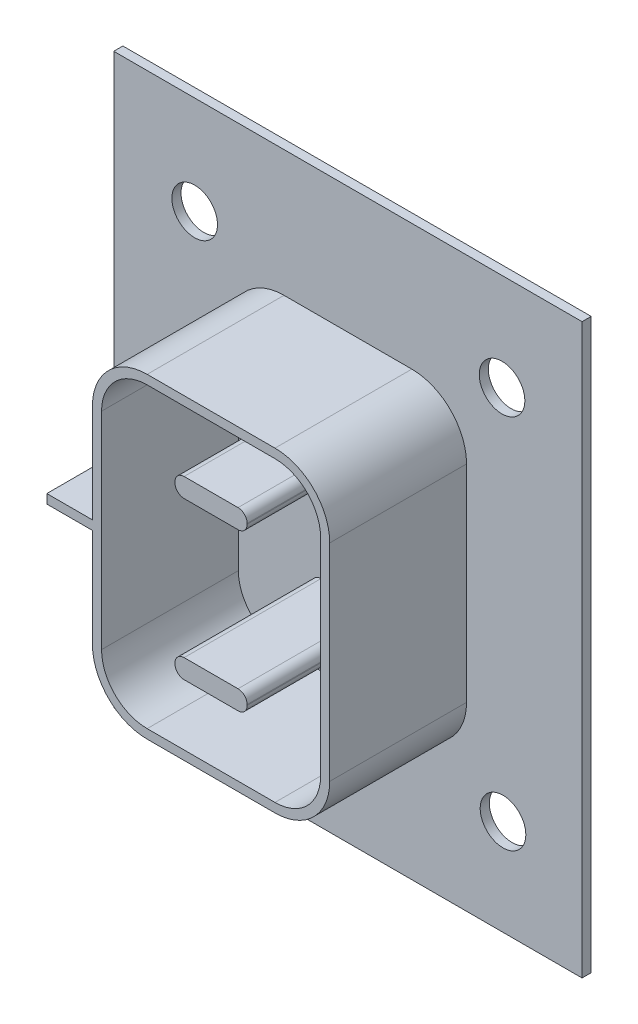
from build123d import *

# Parameters (mm, degrees)
EXTRUDE_1_DEPTH   = 30
EXTRUDE_1_2_DEPTH = 30
EXTRUDE_1_3_DEPTH = 30
SKETCH_2_W        = 102.668849522
SKETCH_2_H        = 124.613288396
SKETCH_2_R        = 5
EXTRUDE_2_DEPTH   = 2


with BuildPart() as part:
    # 草图1 → 凸台-拉伸1 (new body)
    with BuildSketch(Plane.XY):
        with BuildLine():
            ThreePointArc((-26.011198321, 22.633142138), (-22.496479695, 31.118423512), (-14.011198321, 34.633142138))
            Line((-14.011198321, 34.633142138), (14.011198321, 34.633142138))
            ThreePointArc((14.011198321, 34.633142138), (22.496479695, 31.118423512), (26.011198321, 22.633142138))
            Line((26.011198321, 22.633142138), (26.011198321, -22.633142138))
            ThreePointArc((26.011198321, -22.633142138), (22.496479695, -31.118423512), (14.011198321, -34.633142138))
            Line((14.011198321, -34.633142138), (-14.011198321, -34.633142138))
            ThreePointArc((-14.011198321, -34.633142138), (-22.496479695, -31.118423512), (-26.011198321, -22.633142138))
            Line((-26.011198321, -22.633142138), (-26.011198321, -1))
            Line((-26.011198321, -1), (-36.011198321, -1))
            Line((-36.011198321, -1), (-36.011198321, 1))
            Line((-36.011198321, 1), (-26.011198321, 1))
            Line((-26.011198321, 1), (-26.011198321, 22.633142138))
        make_face()
        with BuildLine():
            Line((-24.011198321, 22.633142138), (-24.011198321, -22.633142138))
            ThreePointArc((-24.011198321, -22.633142138), (-21.082266133, -29.70420995), (-14.011198321, -32.633142138))
            Line((-14.011198321, -32.633142138), (14.011198321, -32.633142138))
            ThreePointArc((14.011198321, -32.633142138), (21.082266133, -29.70420995), (24.011198321, -22.633142138))
            Line((24.011198321, -22.633142138), (24.011198321, 22.633142138))
            ThreePointArc((24.011198321, 22.633142138), (21.082266133, 29.70420995), (14.011198321, 32.633142138))
            Line((14.011198321, 32.633142138), (-14.011198321, 32.633142138))
            ThreePointArc((-14.011198321, 32.633142138), (-21.082266133, 29.70420995), (-24.011198321, 22.633142138))
        make_face(mode=Mode.SUBTRACT)
    extrude(amount=EXTRUDE_1_DEPTH)

    # 草图2 → 凸台-拉伸2 (add)
    with BuildSketch(Plane.XY):
        Rectangle(SKETCH_2_W, SKETCH_2_H)
        with Locations((-33.977994318, -41.240450485)):
            Circle(SKETCH_2_R, mode=Mode.SUBTRACT)
        with Locations((34.002429765, -41.270108764)):
            Circle(SKETCH_2_R, mode=Mode.SUBTRACT)
        with Locations((33.788584472, 41.01055618)):
            Circle(SKETCH_2_R, mode=Mode.SUBTRACT)
        with Locations((-33.591248628, 40.771041775)):
            Circle(SKETCH_2_R, mode=Mode.SUBTRACT)
    extrude(amount=-EXTRUDE_2_DEPTH)


with BuildPart() as body_2:
    # 草图1 → Extrude 1 2 (new body)
    with BuildSketch(Plane.XY):
        with BuildLine():
            ThreePointArc((5.908394367, 19.291424928), (7.322607929, 18.705638491), (7.908394367, 17.291424928))
            Line((7.908394367, 17.291424928), (7.908394367, 17.099147011))
            ThreePointArc((7.908394367, 17.099147011), (7.322607929, 15.684933449), (5.908394367, 15.099147011))
            Line((5.908394367, 15.099147011), (-5.908394367, 15.099147011))
            ThreePointArc((-5.908394367, 15.099147011), (-7.322607929, 15.684933449), (-7.908394367, 17.099147011))
            Line((-7.908394367, 17.099147011), (-7.908394367, 17.291424928))
            ThreePointArc((-7.908394367, 17.291424928), (-7.322607929, 18.705638491), (-5.908394367, 19.291424928))
            Line((-5.908394367, 19.291424928), (5.908394367, 19.291424928))
        make_face()
    extrude(amount=EXTRUDE_1_2_DEPTH)


with BuildPart() as body_3:
    # 草图1 → Extrude 1 3 (new body)
    with BuildSketch(Plane.XY):
        with BuildLine():
            Line((-7.908394367, -17.291424928), (-7.908394367, -17.099147011))
            ThreePointArc((-7.908394367, -17.099147011), (-7.322607929, -15.684933449), (-5.908394367, -15.099147011))
            Line((-5.908394367, -15.099147011), (5.908394367, -15.099147011))
            ThreePointArc((5.908394367, -15.099147011), (7.322607929, -15.684933449), (7.908394367, -17.099147011))
            Line((7.908394367, -17.099147011), (7.908394367, -17.291424928))
            ThreePointArc((7.908394367, -17.291424928), (7.322607929, -18.705638491), (5.908394367, -19.291424928))
            Line((5.908394367, -19.291424928), (-5.908394367, -19.291424928))
            ThreePointArc((-5.908394367, -19.291424928), (-7.322607929, -18.705638491), (-7.908394367, -17.291424928))
        make_face()
    extrude(amount=EXTRUDE_1_3_DEPTH)


solid = Compound([part.part, body_2.part, body_3.part])
